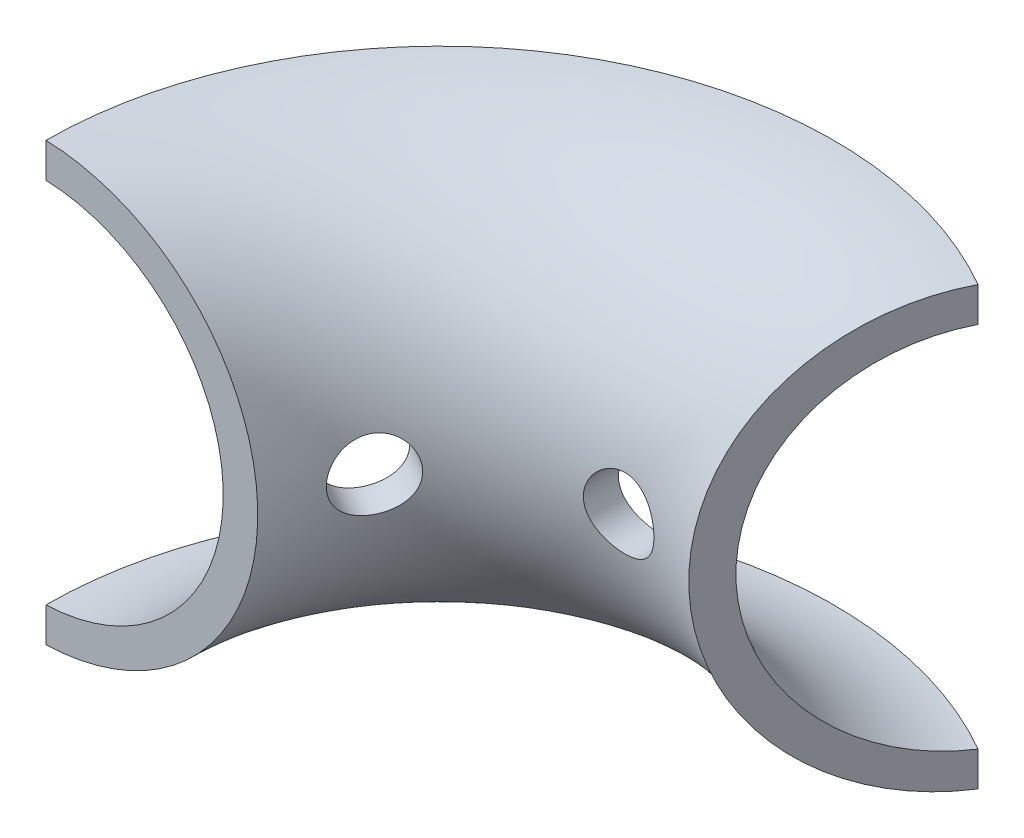
from build123d import *

# Parameters (mm, degrees)
F_5_0MM_DOWEL_HOLE1_D               = 5.2
F_5_0MM_DOWEL_HOLE1_DEPTH           = 5
F_5_0MM_DOWEL_HOLE1_TIP             = 1.562237609
F_5_0MM_DOWEL_HOLE1_ON_FACE_2_D     = 5.2
F_5_0MM_DOWEL_HOLE1_ON_FACE_2_DEPTH = 5
F_5_0MM_DOWEL_HOLE1_ON_FACE_2_TIP   = 1.562237609


with BuildPart() as part:
    # Sweep1: sweep along a path in Sketch2
    with BuildLine(Plane(origin=(0, 0, 0), x_dir=(1, 0, 0), z_dir=(0, 1, 0))) as sweep1_path:
        ThreePointArc((44.295, 25.573730174), (14.765, 25.573730174), (0, 0))
    # Sketch1 → Sweep1 (sweep)
    with BuildSketch(Plane.XY):
        with BuildLine():
            Line((0.5, 16.097236564), (0.5, 13.550778575))
            ThreePointArc((0.5, 13.550778575), (13.56, 0), (0.5, -13.550778575))
            Line((0.5, -13.550778575), (0.5, -16.097236564))
            ThreePointArc((0.5, -16.097236564), (16.105, 0), (0.5, 16.097236564))
        make_face()
    sweep(path=sweep1_path.line)

    # Ø5.0mm Dowel Hole1
    with Locations(Plane(origin=(29.53, 0, -13.425), x_dir=(1, 0, 0), z_dir=(0, 0, 1))):
        with Locations((0, 0)):
            Hole(F_5_0MM_DOWEL_HOLE1_D / 2, depth=F_5_0MM_DOWEL_HOLE1_DEPTH)
            with Locations((0, 0, -(F_5_0MM_DOWEL_HOLE1_DEPTH + F_5_0MM_DOWEL_HOLE1_TIP / 2))):  # 118° drill point
                Cone(0, F_5_0MM_DOWEL_HOLE1_D / 2, F_5_0MM_DOWEL_HOLE1_TIP, mode=Mode.SUBTRACT)

    # Ø5.0mm Dowel Hole1 on face 2
    with Locations(Plane(origin=(17.903608954, 0, -6.7125), x_dir=(-0.500000174844, 0, 0.866025302838), z_dir=(0.866025302838, 0, 0.500000174844))):
        with Locations((0, 0)):
            Hole(F_5_0MM_DOWEL_HOLE1_ON_FACE_2_D / 2, depth=F_5_0MM_DOWEL_HOLE1_ON_FACE_2_DEPTH)
            with Locations((0, 0, -(F_5_0MM_DOWEL_HOLE1_ON_FACE_2_DEPTH + F_5_0MM_DOWEL_HOLE1_ON_FACE_2_TIP / 2))):  # 118° drill point
                Cone(0, F_5_0MM_DOWEL_HOLE1_ON_FACE_2_D / 2, F_5_0MM_DOWEL_HOLE1_ON_FACE_2_TIP, mode=Mode.SUBTRACT)


solid = part.part
